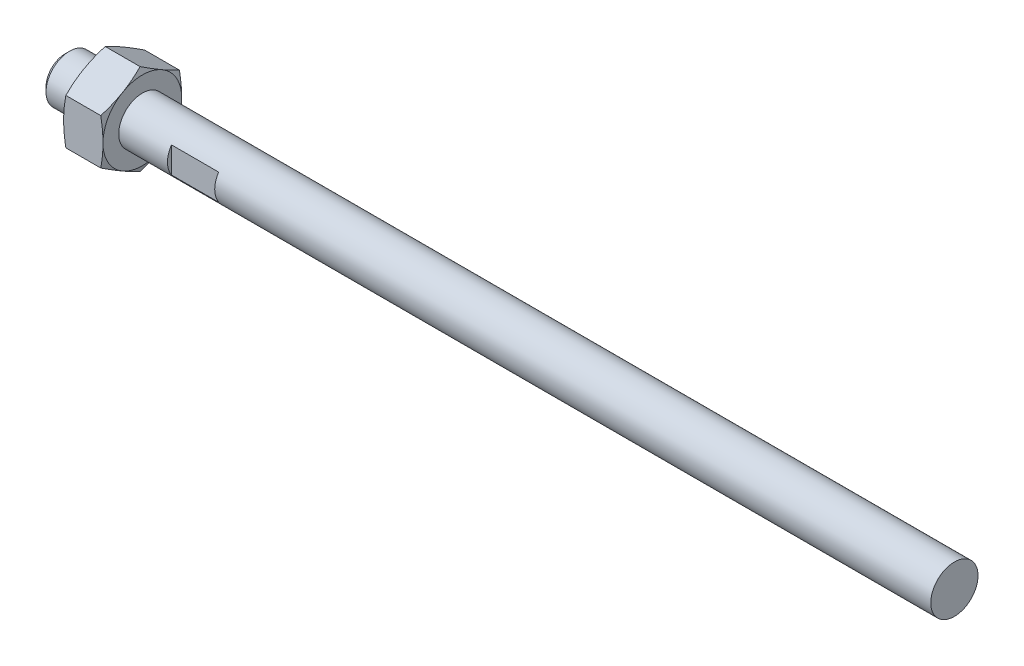
from build123d import *

# Parameters (mm, degrees)
EXTRUDE_START        = -38
SKETCH_3_R           = 3
EXTRUDE_1_DEPTH      = 16
EXTRUDE_START_2      = -33.2
EXTRUDE_2_DEPTH      = 5
SKETCH_5_R           = 3
EXTRUDE_3_DEPTH      = 97
CUT_EXTRUDE_START    = -22
SKETCH_6_OUTSIDE_W   = 34.806
SKETCH_6_OUTSIDE_H   = 36.354
SKETCH_6_OUTSIDE_W_2 = 5
SKETCH_6_OUTSIDE_H_2 = 11.547005384
CUT_EXTRUDE_1_DEPTH  = 6
CHAMFER_1_SIZE       = 0.56


with BuildPart() as part:
    # 草图3 → 凸台-拉伸1 (new body)
    with BuildSketch(Plane(origin=(0, 0, 0), x_dir=(0, 0, -1), z_dir=(1, 0, 0)).offset(EXTRUDE_START)):
        Circle(SKETCH_3_R)
    extrude(amount=EXTRUDE_1_DEPTH)

    # 草图4 → 凸台-拉伸2 (add)
    with BuildSketch(Plane(origin=(0, 0, 0), x_dir=(0, 0, -1), z_dir=(1, 0, 0)).offset(EXTRUDE_START_2)):
        Polygon((0, -5.773502692), (5, -2.886751346), (5, 2.886751346), (0, 5.773502692), (-5, 2.886751346), (-5, -2.886751346), align=None)
    extrude(amount=EXTRUDE_2_DEPTH)

    # 草图5 → 凸台-拉伸3 (add)
    with BuildSketch(Plane(origin=(-22, 0, 0), x_dir=(0, 0, -1), z_dir=(1, 0, 0))):
        Circle(SKETCH_5_R)
    extrude(amount=EXTRUDE_3_DEPTH)

    # 草图6 outside → 切除-拉伸1 (cut)
    with BuildSketch(Plane(origin=(0, 0, 0), x_dir=(0, 0, -1), z_dir=(1, 0, 0)).offset(CUT_EXTRUDE_START)):
        Rectangle(SKETCH_6_OUTSIDE_W, SKETCH_6_OUTSIDE_H)
        Rectangle(SKETCH_6_OUTSIDE_W_2, SKETCH_6_OUTSIDE_H_2, mode=Mode.SUBTRACT)
    extrude(amount=CUT_EXTRUDE_1_DEPTH, mode=Mode.SUBTRACT)

    # 草图7 → 切除-旋转1 (revolve, cut)
    with BuildSketch(Plane(origin=(0, 0, 0), x_dir=(1, 0, 0), z_dir=(0, 1, 0))):
        Polygon((-33.2, 5), (-33.2, 16.868693549), (-28.2, 16.868693549), (-28.2, 5), (-30.7, 11.868693549), align=None)
    revolve(axis=Axis((-16, 0, 0), (-1, 0, 0)), mode=Mode.SUBTRACT)

    # 倒角1
    chamfer_1_edges = [part.edges().sort_by_distance(p)[0] for p in [
        (-38, 0, 3),
    ]]
    chamfer(chamfer_1_edges, length=CHAMFER_1_SIZE)


solid = part.part
